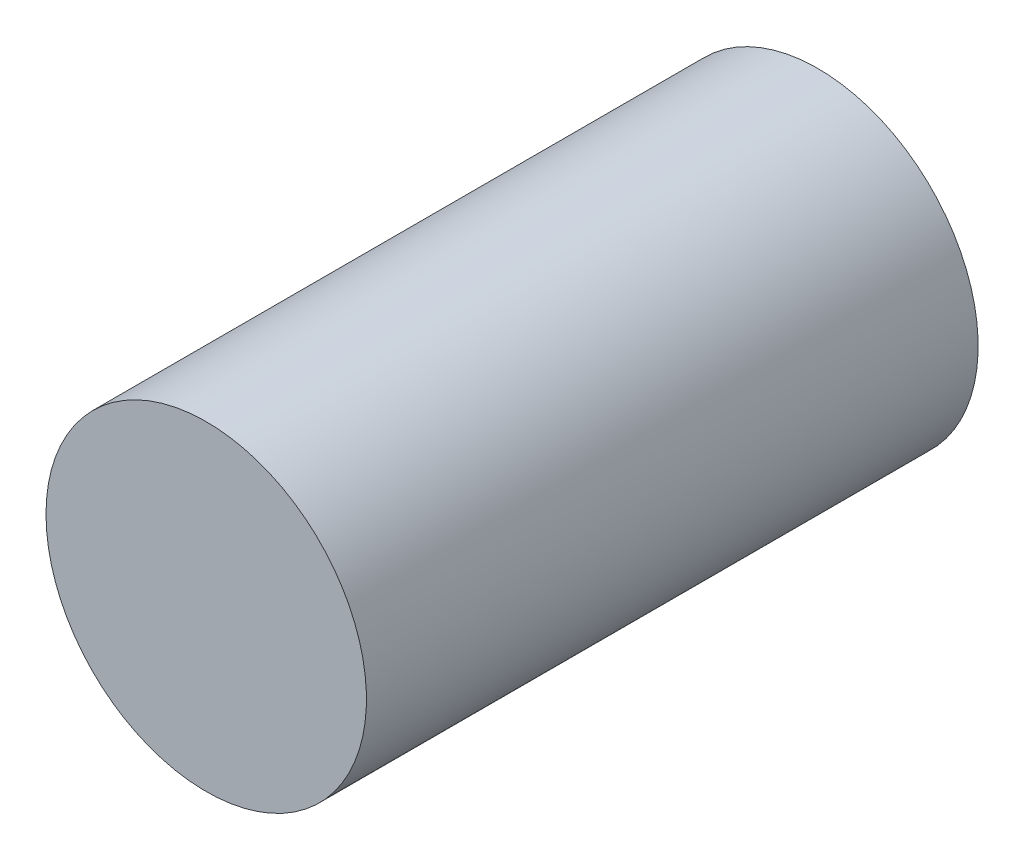
from build123d import *

# Parameters (mm, degrees)
SKETCH1_R      = 5.5
ENVELOPE_DEPTH = 21


with BuildPart() as part:
    # Sketch1 → Envelope (new body)
    with BuildSketch(Plane.XY):
        with Locations(Location((0, 0, 0), (0, 0, 180))):
            Circle(SKETCH1_R)
    extrude(amount=ENVELOPE_DEPTH)


solid = part.part
